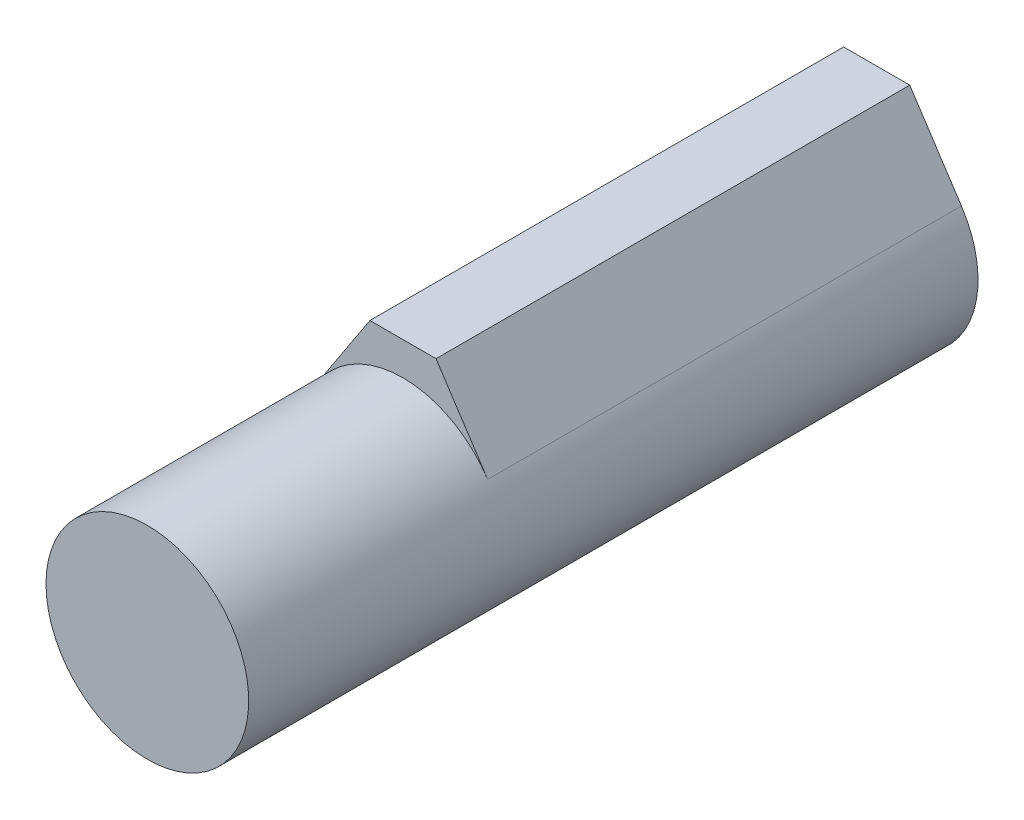
from build123d import *

# Parameters (mm, degrees)
EXTRUDE_3_DEPTH = 43
SKETCH_3_R      = 9.2
EXTRUDE_4_DEPTH = 66.2


with BuildPart() as part:
    # 草图1 → 凸台-拉伸3 (new body)
    with BuildSketch(Plane.XY):
        with BuildLine():
            Line((-3, 12.2), (3, 12.2))
            Line((3, 12.2), (7.692674554, 5.046063634))
            ThreePointArc((7.692674554, 5.046063634), (0, -9.2), (-7.692674554, 5.046063634))
            Line((-7.692674554, 5.046063634), (-3, 12.2))
        make_face()
    extrude(amount=EXTRUDE_3_DEPTH)

    # 草图3 → 凸台-拉伸4 (add)
    with BuildSketch(Plane(origin=(0, 0, 0), x_dir=(-1, 0, 0), z_dir=(0, 0, -1))):
        Circle(SKETCH_3_R)
    extrude(amount=-EXTRUDE_4_DEPTH)


solid = part.part
